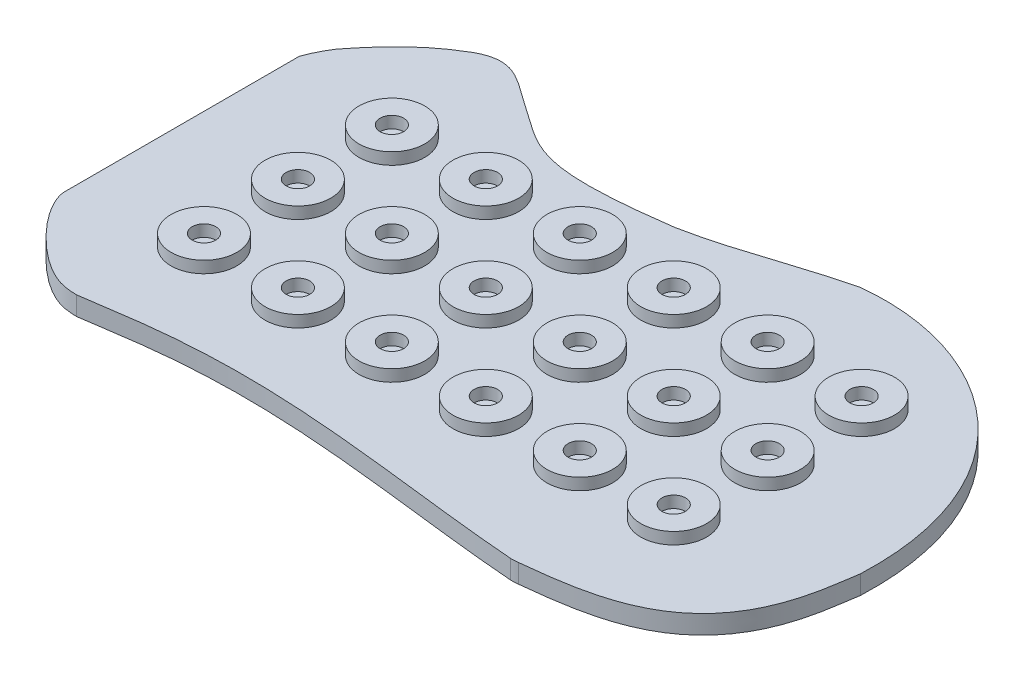
from build123d import *

# Parameters (mm, degrees)
BOSS_EXTRUDE2_DEPTH  = 4
SKETCH2_R            = 7
BOSS_EXTRUDE3_DEPTH  = 2.5
SKETCH4_R            = 2.5
CUT_EXTRUDE1_DEPTH   = 2.5
LPATTERN1_COUNT      = 3
LPATTERN1_PITCH      = 20
LPATTERN1_COUNT_DIR2 = 6
LPATTERN1_PITCH_DIR2 = 20


with BuildPart() as part:
    # Sketch1 → Boss-Extrude2 (new body)
    with BuildSketch(Plane(origin=(0, 0, 0), x_dir=(1, 0, 0), z_dir=(0, 1, 0))):
        with BuildLine():
            Line((-77.610928287, 24.73480995), (-77.610926739, -10.995486899))
            Line((-77.610926739, -10.995486899), (77.512336703, -10.995486899))
            add(Edge.make_bspline(
                [(77.512336703, -10.995486899), (77.518560385, -10.957874405), (77.524814965, -10.920112686), (77.531107112, -10.882121857)],
                knots=[1.010486637, 1.010486637, 1.010486637, 1.010486637, 1.01412385, 1.01412385, 1.01412385, 1.01412385], degree=3))
            add(Edge.make_bspline(
                [(77.531107112, -10.882121857), (77.574839436, -9.766511083), (77.609892635, -7.507402328), (77.488817492, -4.272864758), (77.205757806, -1.125162749), (76.619514408, 2.937285367), (75.50877626, 7.753752623), (72.989524017, 14.905909338), (68.566776195, 22.780014071), (61.595696469, 30.463398286), (53.335691478, 36.314584962), (44.158321293, 40.264828436), (34.449835996, 42.250559646), (27.85746121, 42.205857253), (24.60638519, 41.843406408)],
                knots=[0.000169226, 0.000169226, 0.000169226, 0.000169226, 0.031413574, 0.062657922, 0.09390227, 0.125146618, 0.187635314, 0.25012401, 0.375101401, 0.500078793, 0.625056185, 0.750033577, 0.875010969, 0.999988361, 0.999988361, 0.999988361, 0.999988361], degree=3))
            add(Edge.make_bspline(
                [(24.60638519, 41.843406408), (19.441654305, 40.599557497), (11.868641969, 38.10186056), (1.706905963, 34.941445063), (-3.490903085, 33.661503777), (-6.113060784, 33.160531214)],
                knots=[0.000658959, 0.000658959, 0.000658959, 0.000658959, 0.498067368, 0.746771573, 0.995475778, 0.995475778, 0.995475778, 0.995475778], degree=3))
            add(Edge.make_bspline(
                [(-6.113060784, 33.160531214), (-7.141691771, 33.016316508), (-9.182526978, 32.742024746), (-13.41706461, 32.236967498), (-18.636406478, 31.76535684), (-24.35525076, 31.602322531), (-29.284430774, 31.960023989), (-33.420361612, 32.921566077), (-36.371506688, 34.261606006), (-38.649706949, 35.648097323), (-40.392953753, 36.835956096), (-41.960752384, 37.950009586), (-43.317594841, 38.899351268), (-44.070083407, 39.410677407), (-44.439121999, 39.658722592)],
                knots=[-0.00019559, -0.00019559, -0.00019559, -0.00019559, 0.062587211, 0.125370012, 0.250935613, 0.376501215, 0.502066816, 0.627632417, 0.753198019, 0.81598082, 0.87876362, 0.941546421, 0.972937821, 1.004329222, 1.004329222, 1.004329222, 1.004329222], degree=3))
            add(Edge.make_bspline(
                [(-44.439121999, 39.658722592), (-44.698278493, 39.837478936), (-45.221943057, 40.202686415), (-46.204449693, 40.903278583), (-47.345032131, 41.729218311), (-48.599765224, 42.619793879), (-50.15090873, 43.651280208), (-51.914572875, 44.618913698), (-53.861511808, 45.22944075), (-55.705524128, 45.327541985), (-57.164765963, 45.050979151), (-58.248551256, 44.683932663), (-59.000335406, 44.361625817), (-59.68368912, 44.01293032), (-60.037538284, 43.806100934), (-60.223947924, 43.693990747)],
                knots=[-0.002497219, -0.002497219, -0.002497219, -0.002497219, 0.029065652, 0.060628523, 0.123754265, 0.186880007, 0.250005749, 0.376257234, 0.502508718, 0.628760202, 0.755011687, 0.818137429, 0.881263171, 0.944388913, 1.007514655, 1.007514655, 1.007514655, 1.007514655], degree=3))
            add(Edge.make_bspline(
                [(-60.223947924, 43.693990747), (-60.647418813, 43.446259773), (-61.492438659, 42.931359573), (-63.090560833, 41.877343183), (-65.712449046, 39.946479206), (-68.970886279, 37.019932698), (-71.698068002, 34.035828956), (-73.643714468, 31.694824796), (-74.523586793, 30.588052824), (-74.969576783, 30.022283972)],
                knots=[0.000174078, 0.000174078, 0.000174078, 0.000174078, 0.062881444, 0.12558881, 0.251003541, 0.501833004, 0.752662466, 0.878077198, 1.003491929, 1.003491929, 1.003491929, 1.003491929], degree=3))
            add(Edge.make_bspline(
                [(-74.969576783, 30.022283972), (-75.519545883, 29.19186114), (-76.530249869, 27.448037515), (-77.287396087, 25.657695857), (-77.610928287, 24.73480995)],
                knots=[0.499549048, 0.499549048, 0.499549048, 0.499549048, 0.499765799, 0.49998255, 0.49998255, 0.49998255, 0.49998255], degree=3))
        make_face()
        with BuildLine():
            Line((77.512336703, -10.995486899), (-77.610926739, -10.995486899))
            Line((-77.610926739, -10.995486899), (-77.610926696, -11.995486899))
            Line((-77.610926696, -11.995486899), (77.352572442, -11.995486899))
            add(Edge.make_bspline(
                [(77.352572442, -11.995486899), (77.358645684, -11.955275612), (77.412259186, -11.602816601), (77.464316371, -11.285695229), (77.512336703, -10.995486899)],
                knots=[0.978851886, 0.978851886, 0.978851886, 0.978851886, 0.982422834, 1.010486637, 1.010486637, 1.010486637, 1.010486637], degree=3))
        make_face()
        with BuildLine():
            Line((77.352572442, -11.995486899), (-77.610926696, -11.995486899))
            Line((-77.610926696, -11.995486899), (-77.610926126, -25.14203309))
            add(Edge.make_bspline(
                [(-77.610926126, -25.14203309), (-77.610329581, -25.399956565), (-77.56299042, -25.903042711), (-77.289715127, -26.985745976), (-76.641681648, -28.530602527), (-75.497775654, -30.448110961), (-73.605831916, -33.039049782), (-70.803315368, -36.111993436), (-67.327412016, -39.127002194), (-64.140223394, -41.243972104), (-61.455644843, -42.436069514), (-59.281170991, -42.877843858), (-58.025592683, -42.909198362), (-57.3728408, -42.946603583)],
                knots=[0.000484301, 0.000484301, 0.000484301, 0.000484301, 0.031521334, 0.062558366, 0.124632431, 0.186706496, 0.248780561, 0.37292869, 0.49707682, 0.62122495, 0.745373079, 0.869521209, 0.993669339, 0.993669339, 0.993669339, 0.993669339], degree=3))
            add(Edge.make_bspline(
                [(-57.3728408, -42.946603583), (-57.13064829, -42.917162583), (-56.655899826, -42.857244252), (-55.632891969, -42.716833971), (-54.283173397, -42.517569574), (-52.529691334, -42.248220025), (-50.028198289, -41.865201142), (-46.600250729, -41.367044153), (-42.036258597, -40.811127611), (-37.051373779, -40.355934431), (-29.881163552, -39.94286355), (-20.010895236, -39.876612938), (-6.937670032, -40.617368244), (4.79101559, -41.816338855), (14.569227449, -42.959318591), (22.067232439, -43.838869966), (29.700051426, -44.671831852), (34.887053568, -45.137323321), (37.472492496, -45.32880882)],
                knots=[0.000538145, 0.000538145, 0.000538145, 0.000538145, 0.016151963, 0.031765781, 0.062993416, 0.094221052, 0.125448688, 0.18790396, 0.250359232, 0.312814503, 0.375269775, 0.500180319, 0.625090862, 0.750001406, 0.812456678, 0.874911949, 0.937367221, 0.999822493, 0.999822493, 0.999822493, 0.999822493], degree=3))
            ThreePointArc((37.472492496, -45.32880882), (38.248733412, -45.324262341), (39.021479233, -45.250543112))
            add(Edge.make_bspline(
                [(39.021479233, -45.250543112), (40.554063275, -45.087269156), (43.636191946, -44.744534775), (49.629747374, -43.872748427), (56.64310661, -42.215757501), (63.76459646, -38.913707507), (69.322535256, -34.215518596), (72.595951354, -29.308690908), (74.463908277, -25.056718438), (75.526739474, -21.803040338), (76.297079472, -18.602211114), (76.745734786, -16.093857572), (77.025988143, -14.25776708), (77.200159766, -13.042150967), (77.304730613, -12.312250405), (77.352572442, -11.995486899)],
                knots=[-0.000308659, -0.000308659, -0.000308659, -0.000308659, 0.063093373, 0.126495404, 0.253299468, 0.380103532, 0.506907596, 0.633711659, 0.697113691, 0.760515723, 0.823917755, 0.887319787, 0.919020803, 0.950721818, 0.978851886, 0.978851886, 0.978851886, 0.978851886], degree=3))
        make_face()
    extrude(amount=BOSS_EXTRUDE2_DEPTH)

    # Sketch2 → Boss-Extrude3 (add)
    with BuildSketch(Plane(origin=(0, 4, 0), x_dir=(1, 0, 0), z_dir=(0, 1, 0))):
        with Locations(Location((-52.601285046, 19.444993701, 0), (0, 0, 270))):
            Circle(SKETCH2_R)
    boss_extrude3 = extrude(amount=BOSS_EXTRUDE3_DEPTH)

    # Sketch4 → Cut-Extrude1 (cut)
    with BuildSketch(Plane(origin=(0, 6.5, 0), x_dir=(1, 0, 0), z_dir=(0, 1, 0))):
        with Locations(Location((-52.601285046, 19.444993701, 0), (0, 0, 270))):
            Circle(SKETCH4_R)
    cut_extrude1 = extrude(amount=-CUT_EXTRUDE1_DEPTH, mode=Mode.SUBTRACT)

    # LPattern1: Boss-Extrude3, Cut-Extrude1 3 × 6
    with Locations(*[(j * LPATTERN1_PITCH_DIR2, 0, i * LPATTERN1_PITCH) for i in range(LPATTERN1_COUNT) for j in range(LPATTERN1_COUNT_DIR2) if (i, j) != (0, 0)]):
        add(boss_extrude3)
        add(cut_extrude1, mode=Mode.SUBTRACT)


solid = part.part
